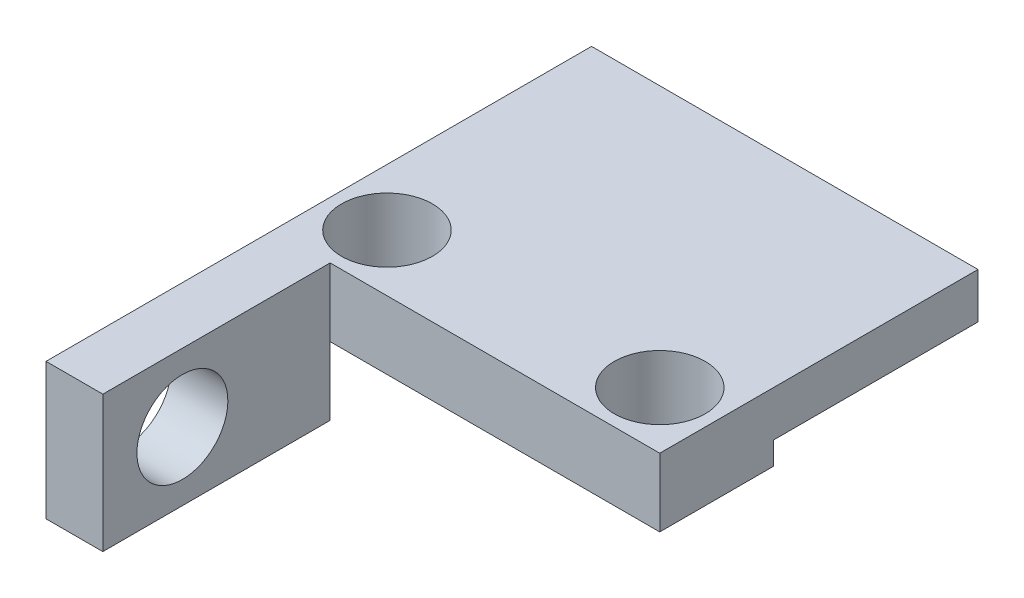
from build123d import *

# Parameters (mm, degrees)
SKETCH_1_W               = 34
SKETCH_1_H               = 28
EXTRUDE_1_DEPTH          = 6
CUT_EXTRUDE_1_DEPTH      = 42.949279402
CUT_EXTRUDE_1_DEPTH_BACK = 42.949279402
CUT_EXTRUDE_3_REACH      = 33.664
SKETCH_5_R               = 4
SKETCH_9_W               = 5
SKETCH_9_H               = 12
EXTRUDE_4_DEPTH          = 20
CUT_EXTRUDE_4_REACH      = 40.227
SKETCH_10_R              = 4


with BuildPart() as part:
    # 草图1 → 凸台-拉伸1 (new body)
    with BuildSketch(Plane(origin=(0, 0, 0), x_dir=(1, 0, 0), z_dir=(0, 1, 0))):
        with Locations((2.971223022, 9.827338129)):
            Rectangle(SKETCH_1_W, SKETCH_1_H)
    extrude(amount=EXTRUDE_1_DEPTH)

    # 草图2 → 切除-拉伸1 (cut, two sides: drawn at the far end of the back side and taken through both)
    with BuildSketch(Plane(origin=(19.971223022, 0, 0), x_dir=(0, 0, -1), z_dir=(1, 0, 0)).offset(-CUT_EXTRUDE_1_DEPTH_BACK)):
        Polygon((90.395880624, 2), (23.827338129, 2), (5.827338129, 2), (5.827338129, 0), (5.827338129, -66.568542495), (89.676932139, -169.983865267), (174.245474634, -101.415322772), align=None)
    extrude(amount=CUT_EXTRUDE_1_DEPTH + CUT_EXTRUDE_1_DEPTH_BACK, mode=Mode.SUBTRACT)

    # 草图5 → 切除-拉伸3 (cut, up to next)
    with BuildSketch(Plane.XZ, mode=Mode.PRIVATE) as cut_extrude_3_sk1:
        with Locations(Location((-9.028776978, -0.827338129, 0), (0, 0, 270))):
            Circle(SKETCH_5_R)
    cut_extrude_3_tool1 = extrude(cut_extrude_3_sk1.sketch, amount=-CUT_EXTRUDE_3_REACH, mode=Mode.PRIVATE) & part.part
    # 草图5 → 切除-拉伸3 (cut, up to next)
    with BuildSketch(Plane.XZ, mode=Mode.PRIVATE) as cut_extrude_3_sk2:
        with Locations(Location((14.971223022, -0.827338129, 0), (0, 0, 270))):
            Circle(SKETCH_5_R)
    cut_extrude_3_tool2 = extrude(cut_extrude_3_sk2.sketch, amount=-CUT_EXTRUDE_3_REACH, mode=Mode.PRIVATE) & part.part
    add(cut_extrude_3_tool1.solids().sort_by_distance((-9.028777, 0, -0.827338))[0], mode=Mode.SUBTRACT)
    add(cut_extrude_3_tool2.solids().sort_by_distance((14.971223, 0, -0.827338))[0], mode=Mode.SUBTRACT)

    # 草图9 → 凸台-拉伸4 (add)
    with BuildSketch(Plane.XY.offset(4.172661871)):
        with Locations((-11.528776978, 0)):
            Rectangle(SKETCH_9_W, SKETCH_9_H)
    extrude(amount=EXTRUDE_4_DEPTH)

    # 草图10 → 切除-拉伸4 (cut, up to next)
    with BuildSketch(Plane(origin=(-9.028776978, 0, 0), x_dir=(0, 0, -1), z_dir=(1, 0, 0)), mode=Mode.PRIVATE) as cut_extrude_4_sk1:
        with Locations(Location((-17.172661871, 0, 0), (0, 0, 90))):
            Circle(SKETCH_10_R)
    cut_extrude_4_tool1 = extrude(cut_extrude_4_sk1.sketch, amount=-CUT_EXTRUDE_4_REACH, mode=Mode.PRIVATE) & part.part
    add(cut_extrude_4_tool1.solids().sort_by_distance((-9.028777, 0, 17.172662))[0], mode=Mode.SUBTRACT)


solid = part.part
